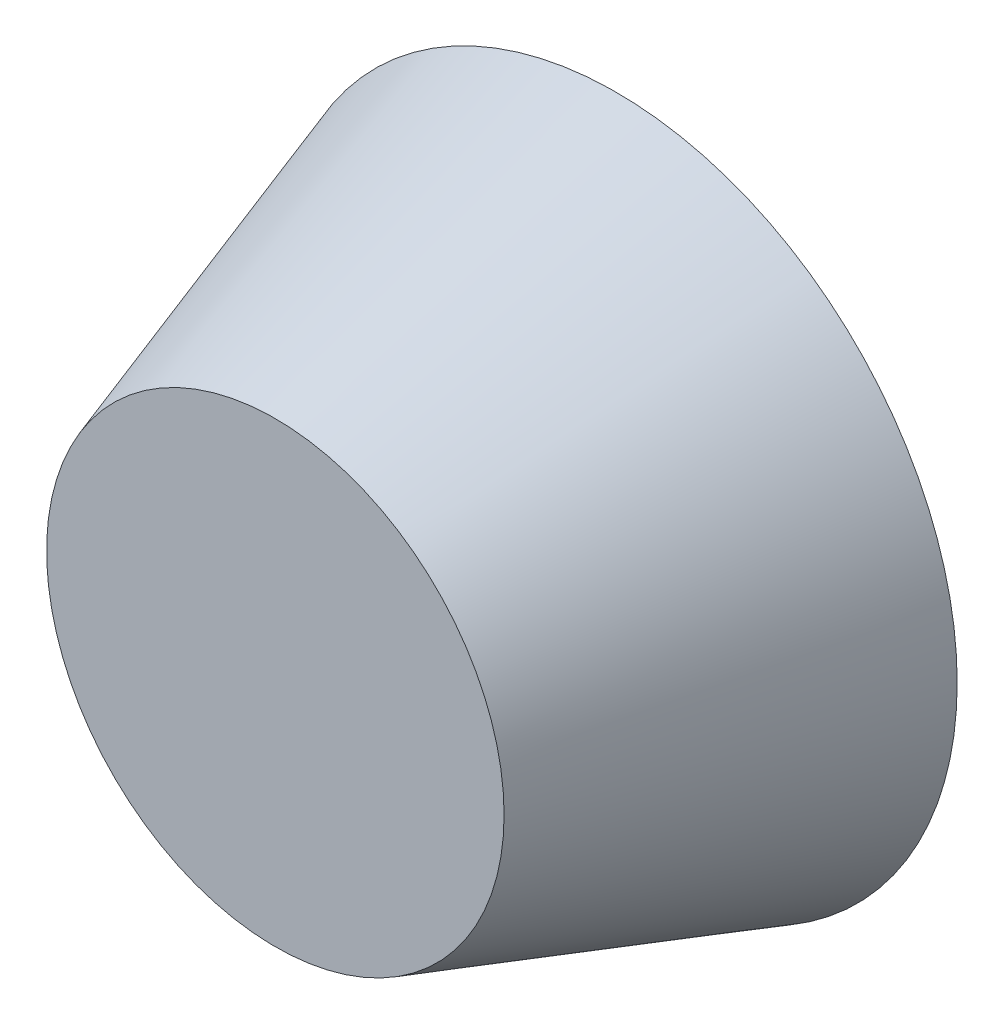
from build123d import *

# Parameters (mm, degrees)
SKETCH1_R = 5
SKETCH3_R = 3.354786073


with BuildPart() as part:
    # Sketch1 → Loft2 section 0
    with BuildSketch(Plane.XY):
        Circle(SKETCH1_R)
    # Sketch3 → Loft2 section 1
    with BuildSketch(Plane.XY.offset(5)):
        Circle(SKETCH3_R)
    loft()


solid = part.part
